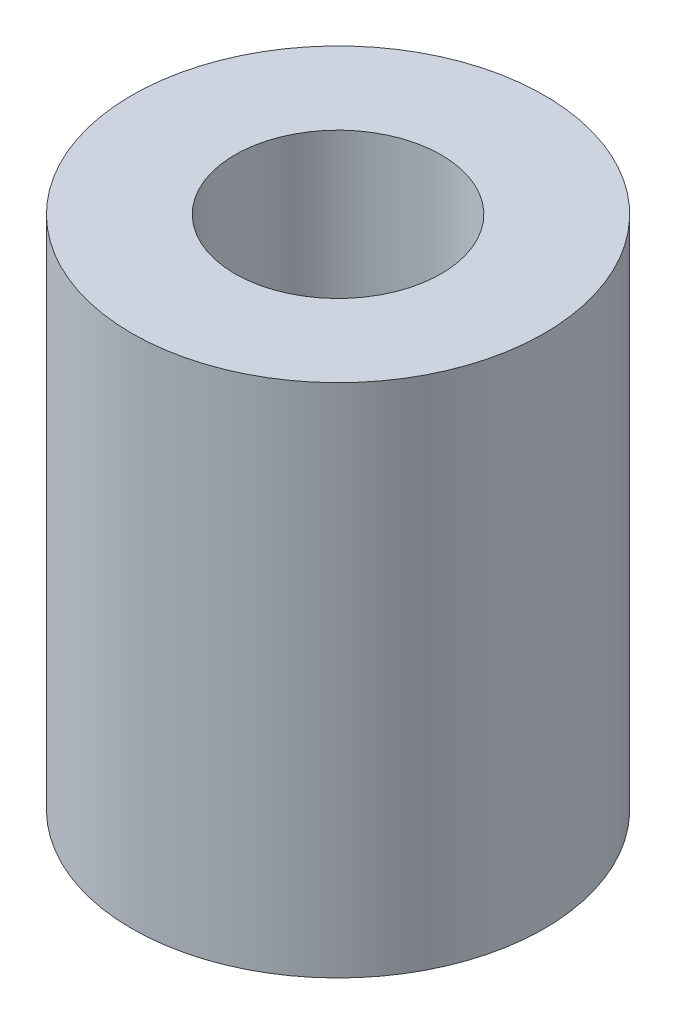
from build123d import *

# Parameters (mm, degrees)
SKETCH1_R           = 10
BOSS_EXTRUDE1_DEPTH = 25
SKETCH2_R           = 3.175
CUT_EXTRUDE1_DEPTH  = 29.722813233
SKETCH3_R           = 5
CUT_EXTRUDE2_DEPTH  = 12.5


with BuildPart() as part:
    # Sketch1 → Boss-Extrude1 (new body)
    with BuildSketch(Plane(origin=(0, 0, 0), x_dir=(1, 0, 0), z_dir=(0, 1, 0))):
        with Locations(Location((0, 0, 0), (0, 0, 270))):
            Circle(SKETCH1_R)
    extrude(amount=BOSS_EXTRUDE1_DEPTH)

    # Sketch2 → Cut-Extrude1 (cut, through all)
    with BuildSketch(Plane(origin=(0, 25, 0), x_dir=(1, 0, 0), z_dir=(0, 1, 0))):
        with Locations(Location((0, 0, 0), (0, 0, 270))):
            Circle(SKETCH2_R)
    extrude(amount=-CUT_EXTRUDE1_DEPTH, mode=Mode.SUBTRACT)

    # Sketch3 → Cut-Extrude2 (cut)
    with BuildSketch(Plane(origin=(0, 25, 0), x_dir=(1, 0, 0), z_dir=(0, 1, 0))):
        with Locations(Location((0, 0, 0), (0, 0, 270))):
            Circle(SKETCH3_R)
    extrude(amount=-CUT_EXTRUDE2_DEPTH, mode=Mode.SUBTRACT)


solid = part.part
